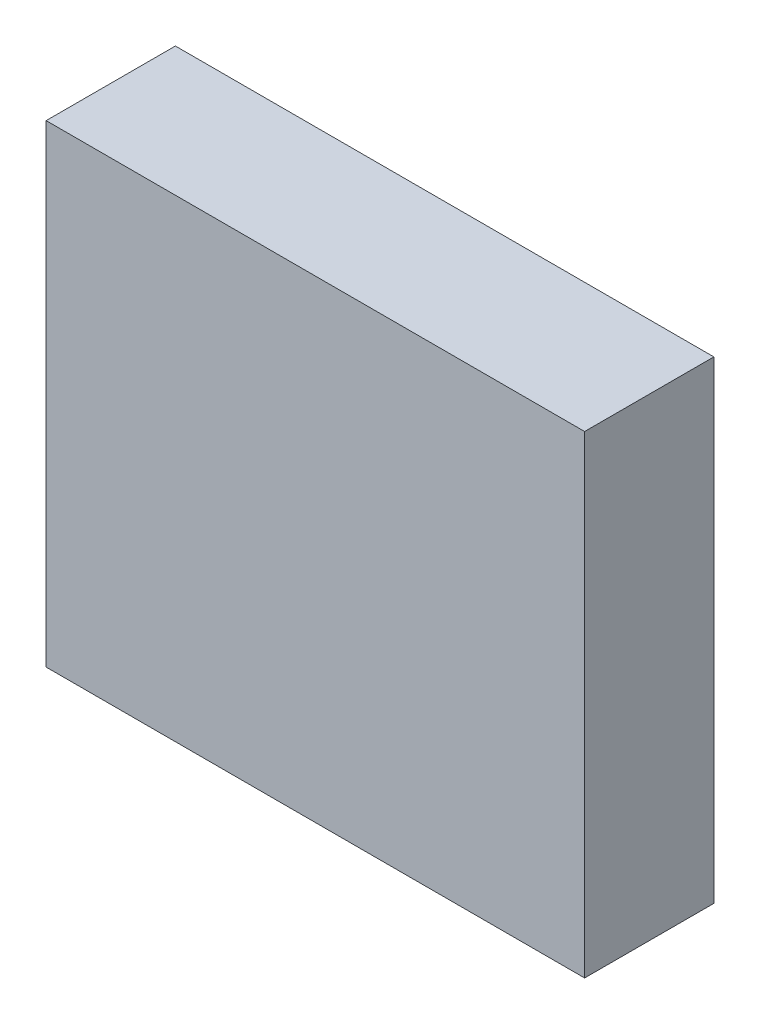
from build123d import *

# Parameters (mm, degrees)
SKETCH1_W               = 4.166594
SKETCH1_H               = 3.662194
COMPONENT_OUTLINE_DEPTH = 1


with BuildPart() as part:
    # Sketch1 → Component_Outline (new body)
    with BuildSketch(Plane.XY):
        with Locations((-0.183297, 0.156097)):
            Rectangle(SKETCH1_W, SKETCH1_H)
    extrude(amount=COMPONENT_OUTLINE_DEPTH)


solid = part.part
